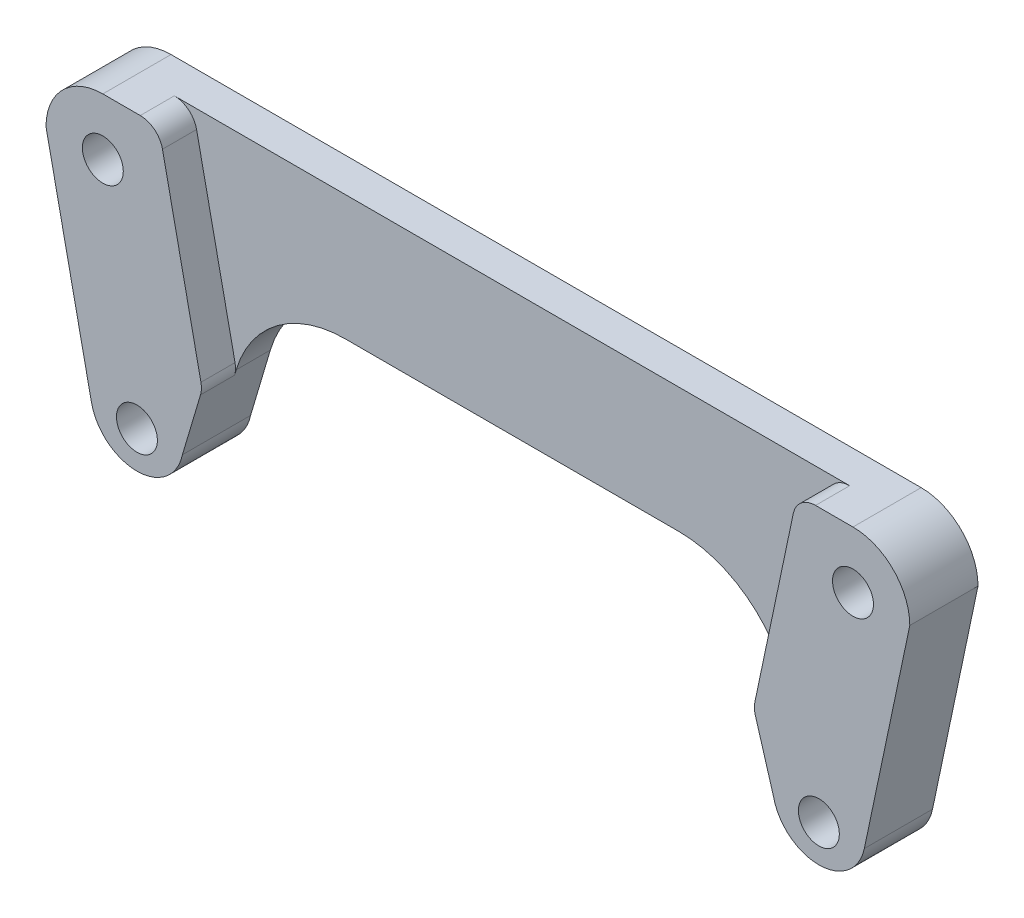
from build123d import *

# Parameters (mm, degrees)
SKETCH_1_R          = 1.8
EXTRUDE_1_DEPTH     = 6
CUT_EXTRUDE_1_DEPTH = 3
FILLET_1_R          = 2


with BuildPart() as part:
    # ｽｹｯﾁ1 → ﾎﾞｽ - 押し出し1 (new body)
    with BuildSketch(Plane.XY):
        with BuildLine():
            Line((-68.800816256, 45.189746609), (-2.800816256, 45.189746609))
            ThreePointArc((-2.800816256, 45.189746609), (0.73471765, 43.725280515), (2.199183744, 40.189746609))
            Line((2.199183744, 40.189746609), (-1.800816256, 21.189746609))
            ThreePointArc((-1.800816256, 21.189746609), (-5.800816256, 17.944170221), (-9.800816256, 21.189746609))
            Line((-9.800816256, 21.189746609), (-11.537510812, 27.036945787))
            ThreePointArc((-11.537510812, 27.036945787), (-15.143316964, 32.20448278), (-21.123618303, 34.189746609))
            Line((-21.123618303, 34.189746609), (-50.478014208, 34.189746609))
            ThreePointArc((-50.478014208, 34.189746609), (-56.458315547, 32.20448278), (-60.0641217, 27.036945787))
            Line((-60.0641217, 27.036945787), (-61.800816256, 21.189746609))
            ThreePointArc((-61.800816256, 21.189746609), (-65.800816256, 17.944170221), (-69.800816256, 21.189746609))
            Line((-69.800816256, 21.189746609), (-73.800816256, 40.189746609))
            ThreePointArc((-73.800816256, 40.189746609), (-72.336350162, 43.725280515), (-68.800816256, 45.189746609))
        make_face()
        with Locations((-68.800816256, 40.189746609)):
            Circle(SKETCH_1_R, mode=Mode.SUBTRACT)
        with Locations((-65.800816256, 21.189746609)):
            Circle(SKETCH_1_R, mode=Mode.SUBTRACT)
        with Locations((-5.800816256, 21.189746609)):
            Circle(SKETCH_1_R, mode=Mode.SUBTRACT)
        with Locations((-2.800816256, 40.189746609)):
            Circle(SKETCH_1_R, mode=Mode.SUBTRACT)
    extrude(amount=EXTRUDE_1_DEPTH)

    # ｽｹｯﾁ2 → ｶｯﾄ - 押し出し1 (cut)
    with BuildSketch(Plane.XY.offset(6)):
        Polygon((-60.0641217, 27.036945787), (-11.537510812, 27.036945787), (-7.715868533, 45.189746609), (-63.885763978, 45.189746609), align=None)
    extrude(amount=-CUT_EXTRUDE_1_DEPTH, mode=Mode.SUBTRACT)

    # ﾌｨﾚｯﾄ1
    fillet_1_edges = [part.edges().sort_by_distance(p)[0] for p in [
        (-11.537510812, 27.036945787, 4.5),
        (-60.0641217, 27.036945787, 4.5),
        (-63.885763978, 45.189746609, 4.5),
        (-7.715868533, 45.189746609, 4.5),
    ]]
    fillet(fillet_1_edges, radius=FILLET_1_R)


solid = part.part
